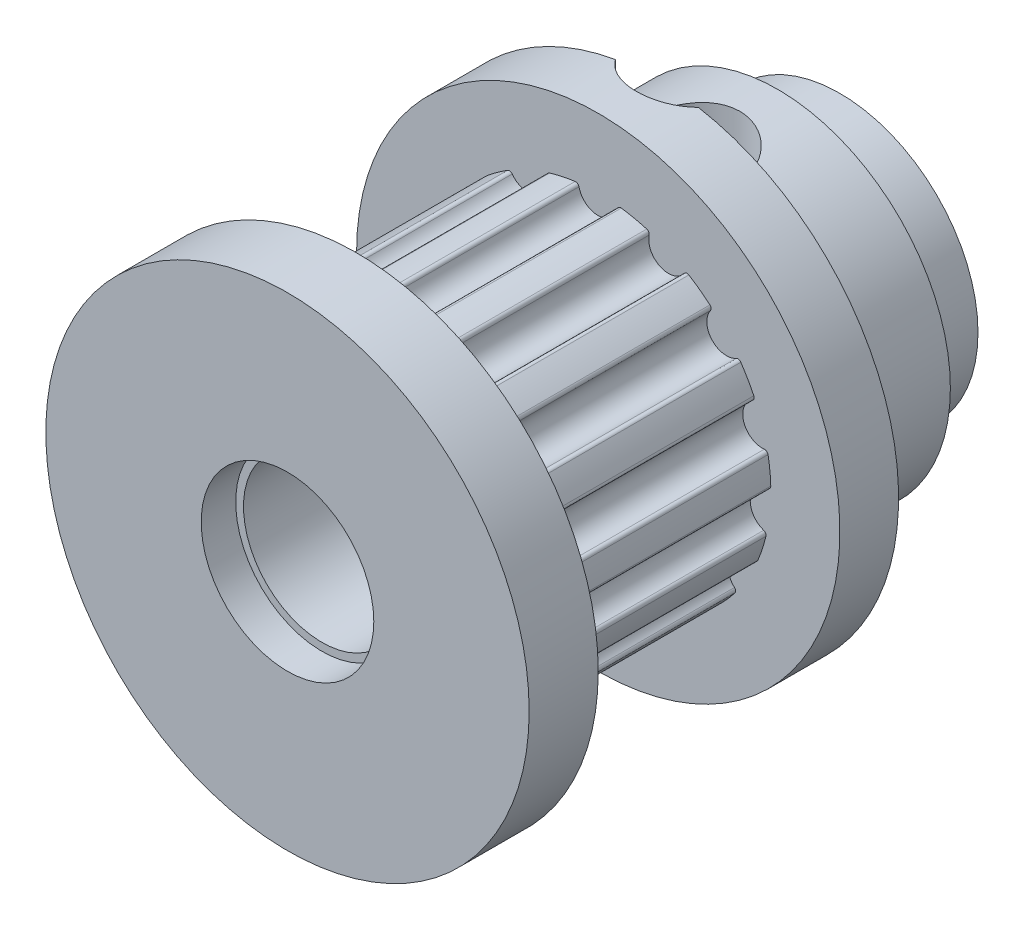
from build123d import *

# Parameters (mm, degrees)
ESBO_O1_R                     = 5
ESBO_O1_R_2                   = 2.275
RESSALTO_EXTRUS_O1_DEPTH      = 13.2
RESSALTO_EXTRUS_O2_START      = -15
ESBO_O2_R                     = 4
ESBO_O2_R_2                   = 2.275
RESSALTO_EXTRUS_O2_DEPTH      = 15
ESBO_O7_R                     = 0.57
CORTE_EXTRUS_O2_DEPTH         = 8
FILETE1_R                     = 0.1
RESSALTO_EXTRUS_O3_DEPTH      = 1.5
RESSALTO_EXTRUS_O3_DEPTH_BACK = 0.2
ESBO_O3_R                     = 7
ESBO_O3_R_2                   = 2.275
RESSALTO_EXTRUS_O4_START      = -1
ESBO_O4_R                     = 7
ESBO_O4_R_2                   = 2.275
RESSALTO_EXTRUS_O4_DEPTH      = 1
ESBO_O6_R                     = 1.5
CORTE_EXTRUS_O1_DEPTH         = 17.499697052
FILETE2_R                     = 0.5
ESBO_O8_R                     = 7
ESBO_O8_R_2                   = 2.5
RESSALTO_EXTRUS_O5_DEPTH      = 1


with BuildPart() as part:
    # Esboço1 → Ressalto-extrusão1 (new body)
    with BuildSketch(Plane.XY):
        Circle(ESBO_O1_R)
        Circle(ESBO_O1_R_2, mode=Mode.SUBTRACT)
    extrude(amount=RESSALTO_EXTRUS_O1_DEPTH)

    # Esboço2 → Ressalto-extrusão2 (add)
    with BuildSketch(Plane.XY.offset(13.2).offset(RESSALTO_EXTRUS_O2_START)):
        Circle(ESBO_O2_R)
        Circle(ESBO_O2_R_2, mode=Mode.SUBTRACT)
    extrude(amount=RESSALTO_EXTRUS_O2_DEPTH)

    # Esboço7 → Corte-extrusão2 (cut)
    with BuildSketch(Plane.XY.offset(13.2)):
        with Locations((0, 5)):
            Circle(ESBO_O7_R)
        with Locations((2.033683215, 4.567727288)):
            Circle(ESBO_O7_R)
        with Locations((3.715724127, 3.345653032)):
            Circle(ESBO_O7_R)
        with Locations((4.755282581, 1.545084972)):
            Circle(ESBO_O7_R)
        with Locations((4.972609477, -0.522642316)):
            Circle(ESBO_O7_R)
        with Locations((4.330127019, -2.5)):
            Circle(ESBO_O7_R)
        with Locations((2.938926261, -4.045084972)):
            Circle(ESBO_O7_R)
        with Locations((1.039558454, -4.890738004)):
            Circle(ESBO_O7_R)
        with Locations((-1.039558454, -4.890738004)):
            Circle(ESBO_O7_R)
        with Locations((-2.938926261, -4.045084972)):
            Circle(ESBO_O7_R)
        with Locations((-4.330127019, -2.5)):
            Circle(ESBO_O7_R)
        with Locations((-4.972609477, -0.522642316)):
            Circle(ESBO_O7_R)
        with Locations((-4.755282581, 1.545084972)):
            Circle(ESBO_O7_R)
        with Locations((-3.715724127, 3.345653032)):
            Circle(ESBO_O7_R)
        with Locations((-2.033683215, 4.567727288)):
            Circle(ESBO_O7_R)
    extrude(amount=-CORTE_EXTRUS_O2_DEPTH, mode=Mode.SUBTRACT)

    # Filete1
    filete1_edges = [part.edges().sort_by_distance(p)[0] for p in [
        (-0.569073282, 4.96751, 9.2),
        (0.569073282, 4.96751, 9.2),
        (-2.540342653, 4.30658324, 9.2),
        (-1.50059403, 4.769509153, 9.2),
        (-4.072363702, 2.901009114, 9.2),
        (-3.310795002, 3.746816843, 9.2),
        (-4.90023607, 0.993824157, 9.2),
        (-4.54852944, 2.076265863, 9.2),
        (-4.880813105, -1.085202025, 9.2),
        (-4.999781816, 0.046709652, 9.2),
        (-4.017453213, -2.976586919, 9.2),
        (-4.586526494, -1.990923081, 9.2),
        (-2.459439163, -4.353292892, 9.2),
        (-3.380219075, -3.684307127, 9.2),
        (-0.476165738, -4.977274976, 9.2),
        (-1.589441068, -4.740641, 9.2),
        (1.589441068, -4.740641, 9.2),
        (0.476165738, -4.977274976, 9.2),
        (3.380219075, -3.684307127, 9.2),
        (2.459439163, -4.353292892, 9.2),
        (4.586526494, -1.990923081, 9.2),
        (4.017453213, -2.976586919, 9.2),
        (4.999781816, 0.046709652, 9.2),
        (4.880813105, -1.085202025, 9.2),
        (4.54852944, 2.076265863, 9.2),
        (4.90023607, 0.993824157, 9.2),
        (3.310795002, 3.746816843, 9.2),
        (4.072363702, 2.901009114, 9.2),
        (1.50059403, 4.769509153, 9.2),
        (2.540342653, 4.30658324, 9.2),
    ]]
    fillet(filete1_edges, radius=FILETE1_R)

    # Esboço3 → Ressalto-extrusão3 (add, two sides: drawn at the far end of the back side and taken through both)
    with BuildSketch(Plane(origin=(0, 0, 5), x_dir=(-1, 0, 0), z_dir=(0, 0, -1)).offset(-RESSALTO_EXTRUS_O3_DEPTH_BACK)):
        Circle(ESBO_O3_R)
        with Locations(Location((0, 0, 0), (0, 0, 180))):
            Circle(ESBO_O3_R_2, mode=Mode.SUBTRACT)
    extrude(amount=RESSALTO_EXTRUS_O3_DEPTH + RESSALTO_EXTRUS_O3_DEPTH_BACK)

    # Esboço4 → Ressalto-extrusão4 (add)
    with BuildSketch(Plane.XY.offset(13.2).offset(RESSALTO_EXTRUS_O4_START)):
        with Locations(Location((0, 0, 0), (0, 0, 180))):
            Circle(ESBO_O4_R)
        Circle(ESBO_O4_R_2, mode=Mode.SUBTRACT)
    extrude(amount=RESSALTO_EXTRUS_O4_DEPTH)

    # Esboço6 → Corte-extrusão1 (cut, through all)
    with BuildSketch(Plane(origin=(0, 0, 0), x_dir=(1, 0, 0), z_dir=(0, 1, 0))):
        with Locations(Location((0, -2.6, 0), (0, 0, 90))):
            Circle(ESBO_O6_R)
    extrude(amount=CORTE_EXTRUS_O1_DEPTH, mode=Mode.SUBTRACT)

    # Filete2
    filete2_edges = [part.edges().sort_by_distance(p)[0] for p in [
        (-2.275, 0, -1.8),
    ]]
    fillet(filete2_edges, radius=FILETE2_R)

    # Esboço8 → Ressalto-extrusão5 (add)
    with BuildSketch(Plane.XY.offset(13.2)):
        with Locations(Location((0, 0, 0), (0, 0, 180))):
            Circle(ESBO_O8_R)
        Circle(ESBO_O8_R_2, mode=Mode.SUBTRACT)
    extrude(amount=RESSALTO_EXTRUS_O5_DEPTH)


solid = part.part
